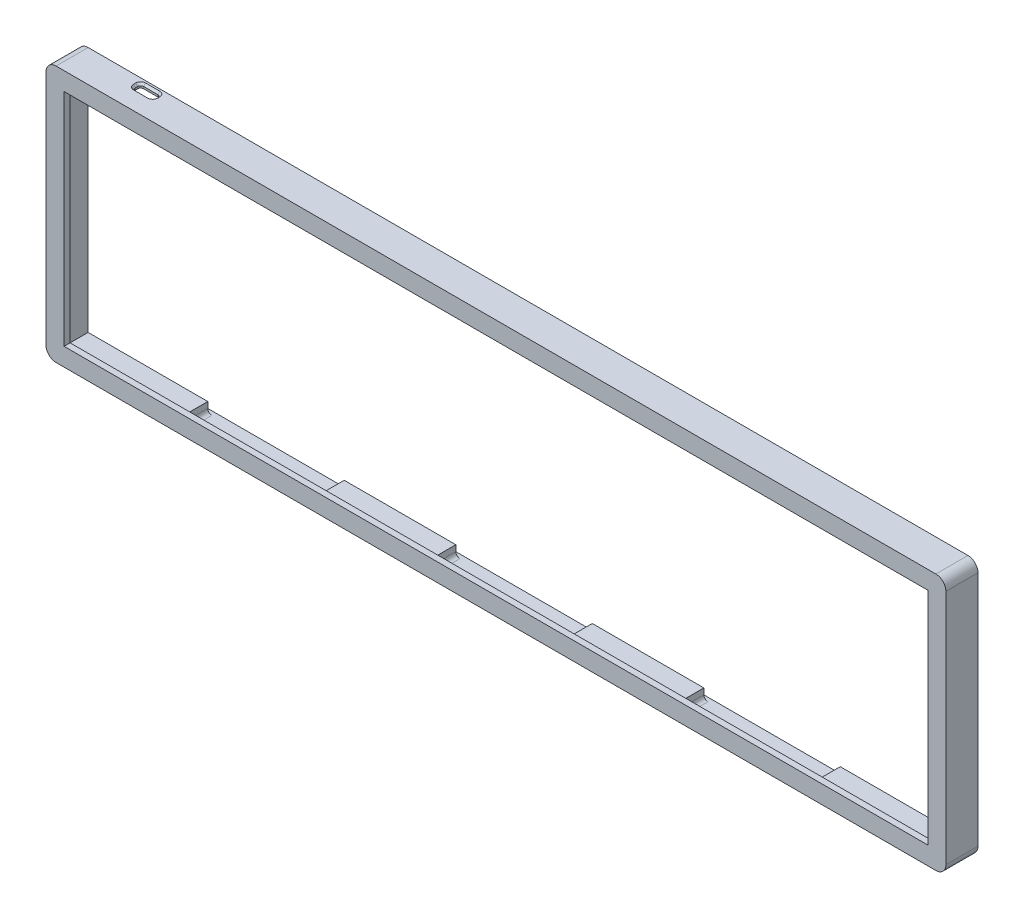
from build123d import *

# Parameters (mm, degrees)
BOSS_EXTRUDE1_DEPTH = 16
SKETCH2_W           = 438.581
SKETCH2_H           = 128
SKETCH2_W_2         = 430.581
SKETCH2_H_2         = 110
BOSS_EXTRUDE2_DEPTH = 3
SKETCH3_W           = 440.5822769
SKETCH3_H           = 124
CUT_EXTRUDE1_DEPTH  = 2
SKETCH4_R           = 1.05
CUT_EXTRUDE2_DEPTH  = 2.5
SKETCH5_W           = 30
SKETCH5_H           = 5
CUT_EXTRUDE3_DEPTH  = 6
CUT_EXTRUDE4_DEPTH  = 4
CHAMFER8_SIZE       = 1


with BuildPart() as part:
    # Sketch1 → Boss-Extrude1 (new body)
    with BuildSketch(Plane.XY):
        with BuildLine():
            ThreePointArc((-7, -2), (-5.535533906, -5.535533906), (-2, -7))
            Line((-2, -7), (436.581, -7))
            ThreePointArc((436.581, -7), (440.116533906, -5.535533906), (441.581, -2))
            Line((441.581, -2), (441.581, 116))
            ThreePointArc((441.581, 116), (440.116533906, 119.535533906), (436.581, 121))
            Line((436.581, 121), (-2, 121))
            ThreePointArc((-2, 121), (-5.535533906, 119.535533906), (-7, 116))
            Line((-7, 116), (-7, -2))
        make_face()
        with BuildLine():
            Line((251.291, 114), (306.936, 114))
            Line((306.936, 114), (306.936, 117))
            ThreePointArc((306.936, 117), (307.521786438, 118.414213562), (308.936, 119))
            Line((308.936, 119), (372.936, 119))
            ThreePointArc((372.936, 119), (374.350213562, 118.414213562), (374.936, 117))
            Line((374.936, 117), (374.936, 114))
            Line((374.936, 114), (434.581, 114))
            Line((434.581, 114), (434.581, 0))
            Line((434.581, 0), (374.936, 0))
            Line((374.936, 0), (374.936, -3))
            ThreePointArc((374.936, -3), (374.350213562, -4.414213562), (372.936, -5))
            Line((372.936, -5), (308.936, -5))
            ThreePointArc((308.936, -5), (307.521786438, -4.414213562), (306.936, -3))
            Line((306.936, -3), (306.936, 0))
            Line((306.936, 0), (251.291, 0))
            Line((251.291, 0), (251.291, -3))
            ThreePointArc((251.291, -3), (250.705213562, -4.414213562), (249.291, -5))
            Line((249.291, -5), (185.291, -5))
            ThreePointArc((185.291, -5), (183.876786438, -4.414213562), (183.291, -3))
            Line((183.291, -3), (183.291, 0))
            Line((183.291, 0), (127.646, 0))
            Line((127.646, 0), (127.646, -3))
            ThreePointArc((127.646, -3), (127.060213562, -4.414213562), (125.646, -5))
            Line((125.646, -5), (61.646, -5))
            ThreePointArc((61.646, -5), (60.231786438, -4.414213562), (59.646, -3))
            Line((59.646, -3), (59.646, 0))
            Line((59.646, 0), (0, 0))
            Line((0, 0), (0, 114))
            Line((0, 114), (59.646, 114))
            Line((59.646, 114), (59.646, 117))
            ThreePointArc((59.646, 117), (60.231786438, 118.414213562), (61.646, 119))
            Line((61.646, 119), (125.646, 119))
            ThreePointArc((125.646, 119), (127.060213562, 118.414213562), (127.646, 117))
            Line((127.646, 117), (127.646, 114))
            Line((127.646, 114), (183.291, 114))
            Line((183.291, 114), (183.291, 117))
            ThreePointArc((183.291, 117), (183.876786438, 118.414213562), (185.291, 119))
            Line((185.291, 119), (249.291, 119))
            ThreePointArc((249.291, 119), (250.705213562, 118.414213562), (251.291, 117))
            Line((251.291, 117), (251.291, 114))
        make_face(mode=Mode.SUBTRACT)
    extrude(amount=BOSS_EXTRUDE1_DEPTH)

    # Sketch2 → Boss-Extrude2 (add)
    with BuildSketch(Plane.XY.offset(16)):
        with Locations((217.2905, 57)):
            Rectangle(SKETCH2_W, SKETCH2_H)
        with Locations((217.2905, 57)):
            Rectangle(SKETCH2_W_2, SKETCH2_H_2, mode=Mode.SUBTRACT)
    extrude(amount=-BOSS_EXTRUDE2_DEPTH)

    # Sketch3 → Cut-Extrude1 (cut)
    with BuildSketch(Plane(origin=(0, 0, 0), x_dir=(-1, 0, 0), z_dir=(0, 0, -1))):
        with Locations((-217.28986155, 57)):
            Rectangle(SKETCH3_W, SKETCH3_H)
    extrude(amount=-CUT_EXTRUDE1_DEPTH, mode=Mode.SUBTRACT)

    # Sketch4 → Cut-Extrude2 (cut)
    with BuildSketch(Plane(origin=(0, 0, 2), x_dir=(-1, 0, 0), z_dir=(0, 0, -1))):
        with Locations((-279.1135, 116.5)):
            Circle(SKETCH4_R)
        with Locations((-155.4685, 116.5)):
            Circle(SKETCH4_R)
        with Locations((-279.1135, -2.5)):
            Circle(SKETCH4_R)
        with Locations((-155.4685, -2.5)):
            Circle(SKETCH4_R)
        with Locations((-2, -2.5)):
            Circle(SKETCH4_R)
        with Locations((-2, 116.5)):
            Circle(SKETCH4_R)
        with Locations((-432.581, 116.5)):
            Circle(SKETCH4_R)
        with Locations((-432.581, -2.5)):
            Circle(SKETCH4_R)
    extrude(amount=-CUT_EXTRUDE2_DEPTH, mode=Mode.SUBTRACT)

    # Sketch5 → Cut-Extrude3 (cut)
    with BuildSketch(Plane(origin=(0, 0, 2), x_dir=(-1, 0, 0), z_dir=(0, 0, -1))):
        with Locations((-32, 116.5)):
            Rectangle(SKETCH5_W, SKETCH5_H)
    extrude(amount=-CUT_EXTRUDE3_DEPTH, mode=Mode.SUBTRACT)

    # Sketch6 → Cut-Extrude4 (cut)
    with BuildSketch(Plane.XZ.offset(-119)):
        with BuildLine():
            Line((34.677255015, 2), (27.677255015, 2))
            ThreePointArc((27.677255015, 2), (26.616594843, 2.439339828), (26.177255015, 3.5))
            Line((26.177255015, 3.5), (26.177255015, 4.5))
            ThreePointArc((26.177255015, 4.5), (26.616594843, 5.560660172), (27.677255015, 6))
            Line((27.677255015, 6), (34.677255015, 6))
            ThreePointArc((34.677255015, 6), (35.737915187, 5.560660172), (36.177255015, 4.5))
            Line((36.177255015, 4.5), (36.177255015, 3.5))
            ThreePointArc((36.177255015, 3.5), (35.737915187, 2.439339828), (34.677255015, 2))
        make_face()
    extrude(amount=-CUT_EXTRUDE4_DEPTH, mode=Mode.SUBTRACT)

    # Chamfer8
    chamfer8_edges = [part.edges().sort_by_distance(p)[0] for p in [
        (31.177255015, 121, 6),
        (26.616594843, 121, 5.560660172),
        (26.177255015, 121, 4),
        (26.616594843, 121, 2.439339828),
        (31.177255015, 121, 2),
        (35.737915187, 121, 2.439339828),
        (36.177255015, 121, 4),
        (35.737915187, 121, 5.560660172),
    ]]
    chamfer(chamfer8_edges, length=CHAMFER8_SIZE)


solid = part.part
